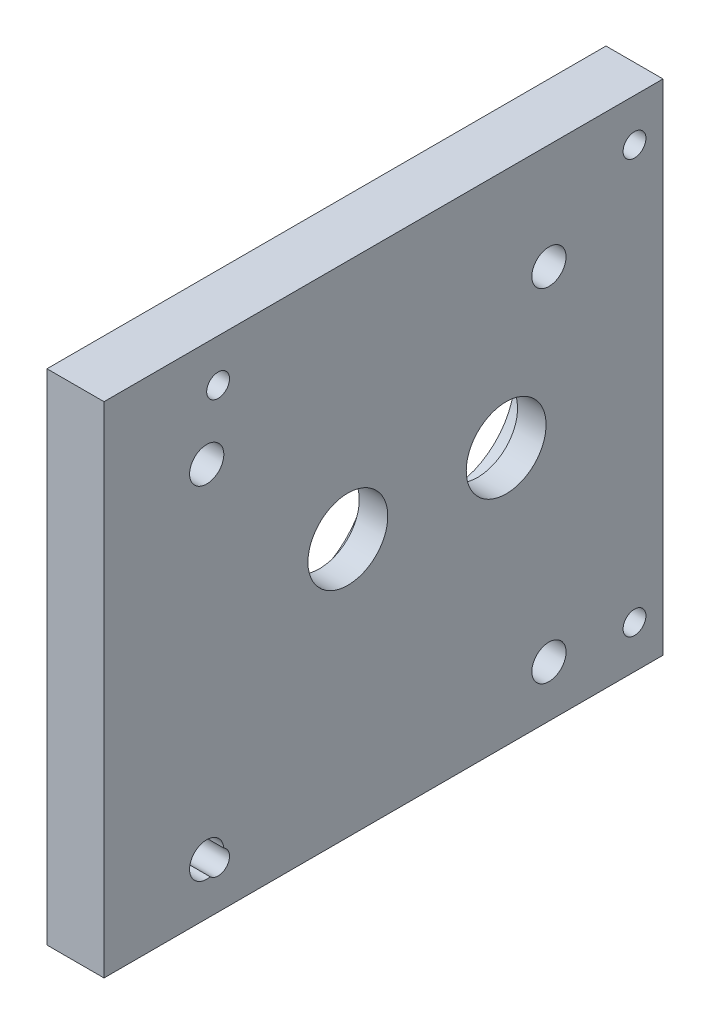
from build123d import *

# Parameters (mm, degrees)
SKETCH1_W           = 20
SKETCH1_H           = 196
BOSS_EXTRUDE1_DEPTH = 175
SKETCH2_R           = 27.5
SKETCH2_R_2         = 23
CUT_EXTRUDE1_DEPTH  = 10
SKETCH3_R           = 14
CUT_EXTRUDE2_DEPTH  = 201.820815654
SKETCH4_R           = 4
CUT_EXTRUDE3_DEPTH  = 202.566366242
SKETCH5_R           = 6
CUT_EXTRUDE4_DEPTH  = 202.566366242
SKETCH6_R           = 4
CUT_EXTRUDE6_DEPTH  = 12


with BuildPart() as part:
    # Sketch1 → Boss-Extrude1 (new body)
    with BuildSketch(Plane(origin=(114, 0, 0), x_dir=(1, 0, 0), z_dir=(0, 1, 0))):
        with Locations((-114, 0)):
            Rectangle(SKETCH1_W, SKETCH1_H)
    extrude(amount=BOSS_EXTRUDE1_DEPTH)

    # Sketch2 → Cut-Extrude1 (cut)
    with BuildSketch(Plane.ZY.offset(10)):
        with Locations((12.5, 90.5)):
            Circle(SKETCH2_R)
        with Locations((-43, 90.5)):
            Circle(SKETCH2_R_2)
    extrude(amount=-CUT_EXTRUDE1_DEPTH, mode=Mode.SUBTRACT)

    # Sketch3 → Cut-Extrude2 (cut, through all)
    with BuildSketch(Plane.ZY):
        with Locations((12.5, 90.5)):
            Circle(SKETCH3_R)
        with Locations((-43, 90.5)):
            Circle(SKETCH3_R)
    extrude(amount=-CUT_EXTRUDE2_DEPTH, mode=Mode.SUBTRACT)

    # Sketch4 → Cut-Extrude3 (cut, through all)
    with BuildSketch(Plane.ZY.offset(10)):
        with Locations((58, 15)):
            Circle(SKETCH4_R)
        with Locations((-88, 15)):
            Circle(SKETCH4_R)
        with Locations((-88, 160)):
            Circle(SKETCH4_R)
        with Locations((58, 160)):
            Circle(SKETCH4_R)
    extrude(amount=-CUT_EXTRUDE3_DEPTH, mode=Mode.SUBTRACT)

    # Sketch5 → Cut-Extrude4 (cut, through all)
    with BuildSketch(Plane.ZY.offset(10)):
        with Locations((62, 138)):
            Circle(SKETCH5_R)
        with Locations((62, 18)):
            Circle(SKETCH5_R)
        with Locations(Location((-58, 138, 0), (0, 0, 180))):
            Circle(SKETCH5_R)
        with Locations((-58, 18)):
            Circle(SKETCH5_R)
    extrude(amount=-CUT_EXTRUDE4_DEPTH, mode=Mode.SUBTRACT)

    # Sketch6 → Cut-Extrude6 (cut)
    with BuildSketch(Plane.XZ):
        with Locations(Location((0, -65, 0), (0, 0, 270))):
            Circle(SKETCH6_R)
        with Locations(Location((0, 35, 0), (0, 0, 90))):
            Circle(SKETCH6_R)
    extrude(amount=-CUT_EXTRUDE6_DEPTH, mode=Mode.SUBTRACT)


solid = part.part
